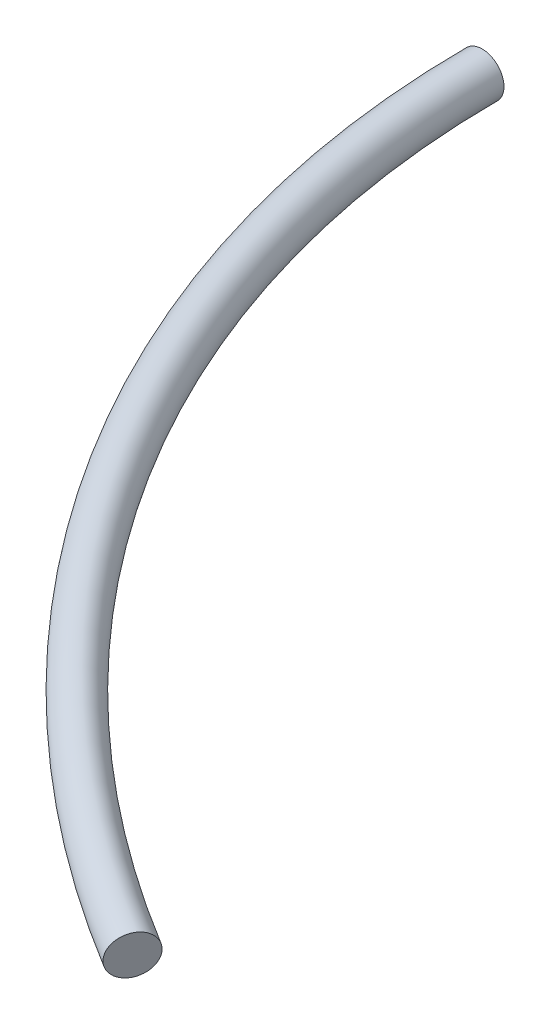
from build123d import *

# Parameters (mm, degrees)
SKETCH1_R = 50.8


with BuildPart() as part:
    # Sweep3: sweep along a path in Sketch3
    with BuildLine(Plane(origin=(-1859.811344962, -11288.564187286, 0), x_dir=(-0.5632230246374148, 0.09279201088692061, 0.821078234539099), z_dir=(0.16256037674540455, 0.9866985983127737, -4.6074255521944004e-15))) as sweep3_path:
        ThreePointArc((-2306.644542353, 3317.946085714), (-1536.680481473, 4244.171856115), (-1351.922350398, 5434.383293551))
    # Sketch1 → Sweep3 (sweep)
    with BuildSketch(Plane.XY):
        with Locations((2127.400365611, -11945.464520318)):
            Circle(SKETCH1_R)
    sweep(path=sweep3_path.line)


solid = part.part
